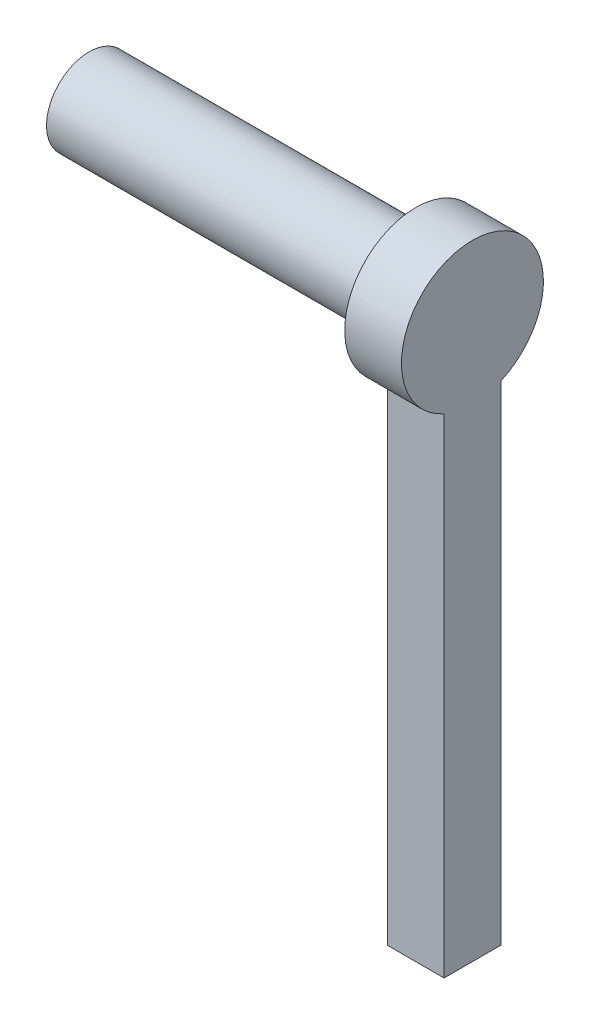
from build123d import *

# Parameters (mm, degrees)
SERVICE_PIN_SHANK_SKETCH_R = 1.5
SERVICE_PIN_SHANK_DEPTH    = 11.5
SERVICE_PIN_HEAD_SKETCH_R  = 2.5
SERVICE_PIN_HEAD_DEPTH     = 2
LOCK_SWITCH_FLAG_SKETCH_W  = 2
LOCK_SWITCH_FLAG_SKETCH_H  = 19.5
LOCK_SWITCH_FLAG_DEPTH     = 2


with BuildPart() as part:
    # Service pin shank sketch → Service pin shank (new body)
    with BuildSketch(Plane(origin=(-12, 0, 0), x_dir=(0, 0, -1), z_dir=(1, 0, 0))):
        with Locations((10.5, -29)):
            Circle(SERVICE_PIN_SHANK_SKETCH_R)
    extrude(amount=SERVICE_PIN_SHANK_DEPTH)

    # Service pin head sketch → Service pin head (add)
    with BuildSketch(Plane(origin=(-0.5, 0, 0), x_dir=(0, 0, -1), z_dir=(1, 0, 0))):
        with Locations((10.5, -29)):
            Circle(SERVICE_PIN_HEAD_SKETCH_R)
    extrude(amount=SERVICE_PIN_HEAD_DEPTH)

    # Lock switch flag sketch → Lock switch flag (add)
    with BuildSketch(Plane.XY.offset(-11.5)):
        with Locations((0.5, -38.75)):
            Rectangle(LOCK_SWITCH_FLAG_SKETCH_W, LOCK_SWITCH_FLAG_SKETCH_H)
    extrude(amount=LOCK_SWITCH_FLAG_DEPTH)


solid = part.part
